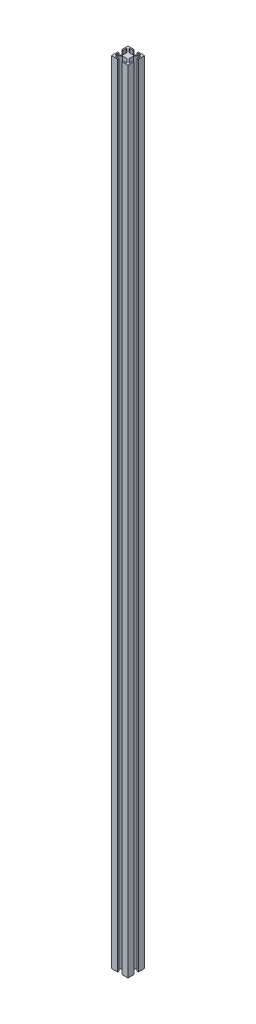
from build123d import *

# Parameters (mm, degrees)
BOSS_EXTRU_1_DEPTH = 950


with BuildPart() as part:
    # Esquisse1 → Boss.-Extru.1 (new body)
    with BuildSketch(Plane(origin=(0, 0, 0), x_dir=(1, 0, 0), z_dir=(0, 1, 0))):
        with BuildLine():
            Line((-10, -2.5), (-10, -10))
            Line((-10, -10), (-2.5, -10))
            Line((-2.5, -10), (-2.5, -8.5))
            Line((-2.5, -8.5), (-6.232233047, -8.5))
            ThreePointArc((-6.232233047, -8.5), (-6.694172813, -8.191341716), (-6.585786438, -7.646446609))
            Line((-6.585786438, -7.646446609), (-2.689339828, -3.75))
            Line((-2.689339828, -3.75), (2.689339828, -3.75))
            Line((2.689339828, -3.75), (6.585786438, -7.646446609))
            ThreePointArc((6.585786438, -7.646446609), (6.694172813, -8.191341716), (6.232233047, -8.5))
            Line((6.232233047, -8.5), (2.5, -8.5))
            Line((2.5, -8.5), (2.5, -10))
            Line((2.5, -10), (10, -10))
            Line((10, -10), (10, -2.5))
            Line((10, -2.5), (8.5, -2.5))
            Line((8.5, -2.5), (8.5, -6.232233047))
            ThreePointArc((8.5, -6.232233047), (8.191341716, -6.694172813), (7.646446609, -6.585786438))
            Line((7.646446609, -6.585786438), (3.75, -2.689339828))
            Line((3.75, -2.689339828), (3.75, 2.689339828))
            Line((3.75, 2.689339828), (7.646446609, 6.585786438))
            ThreePointArc((7.646446609, 6.585786438), (8.191341716, 6.694172813), (8.5, 6.232233047))
            Line((8.5, 6.232233047), (8.5, 2.5))
            Line((8.5, 2.5), (10, 2.5))
            Line((10, 2.5), (10, 10))
            Line((10, 10), (2.5, 10))
            Line((2.5, 10), (2.5, 8.5))
            Line((2.5, 8.5), (6.232233047, 8.5))
            ThreePointArc((6.232233047, 8.5), (6.694172813, 8.191341716), (6.585786438, 7.646446609))
            Line((6.585786438, 7.646446609), (2.689339828, 3.75))
            Line((2.689339828, 3.75), (-2.689339828, 3.75))
            Line((-2.689339828, 3.75), (-6.585786438, 7.646446609))
            ThreePointArc((-6.585786438, 7.646446609), (-6.694172813, 8.191341716), (-6.232233047, 8.5))
            Line((-6.232233047, 8.5), (-2.5, 8.5))
            Line((-2.5, 8.5), (-2.5, 10))
            Line((-2.5, 10), (-10, 10))
            Line((-10, 10), (-10, 2.5))
            Line((-10, 2.5), (-8.5, 2.5))
            Line((-8.5, 2.5), (-8.5, 6.232233047))
            ThreePointArc((-8.5, 6.232233047), (-8.191341716, 6.694172813), (-7.646446609, 6.585786438))
            Line((-7.646446609, 6.585786438), (-3.75, 2.689339828))
            Line((-3.75, 2.689339828), (-3.75, -2.689339828))
            Line((-3.75, -2.689339828), (-7.646446609, -6.585786438))
            ThreePointArc((-7.646446609, -6.585786438), (-8.191341716, -6.694172813), (-8.5, -6.232233047))
            Line((-8.5, -6.232233047), (-8.5, -2.5))
            Line((-8.5, -2.5), (-10, -2.5))
        make_face()
    extrude(amount=BOSS_EXTRU_1_DEPTH)


solid = part.part
